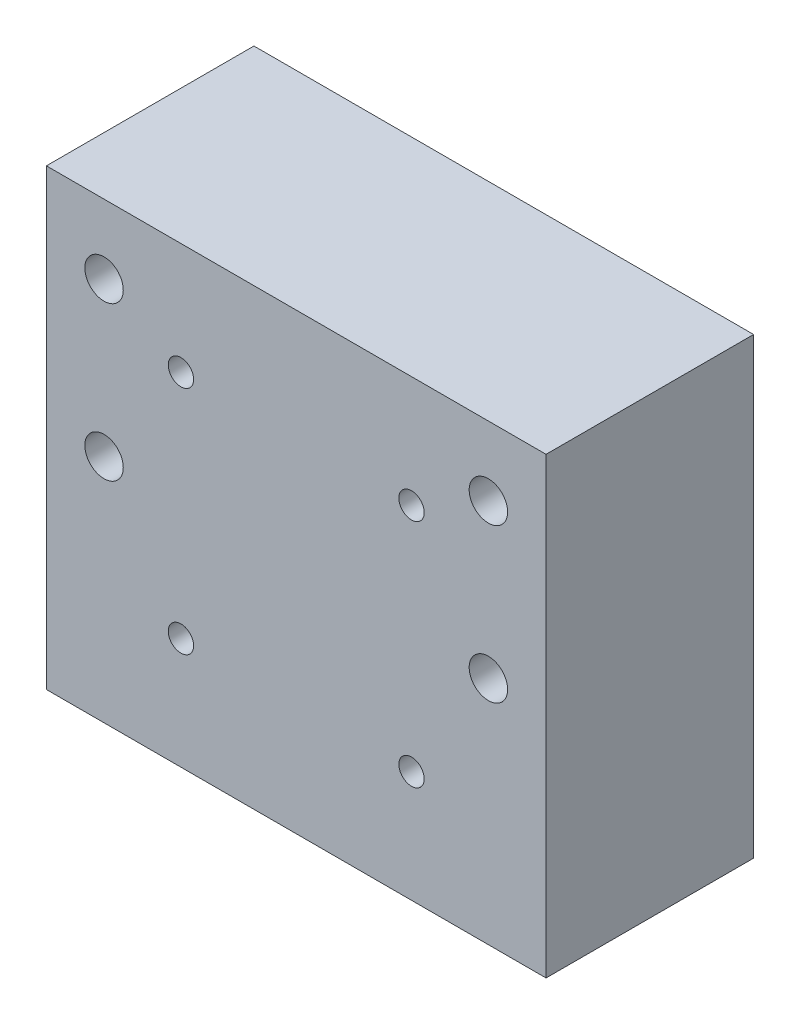
from build123d import *

# Parameters (mm, degrees)
SKETCH_1_W                  = 65
SKETCH_1_H                  = 59
EXTRUDE_1_DEPTH             = 27
SKETCH_2_R                  = 2.5
CUT_EXTRUDE_1_DEPTH         = 27
PATTERN_LINEAR_1_COUNT      = 2
PATTERN_LINEAR_1_PITCH      = 50
PATTERN_LINEAR_1_COUNT_DIR2 = 2
PATTERN_LINEAR_1_PITCH_DIR2 = 20
SKETCH_3_R                  = 1.65
CUT_EXTRUDE_2_DEPTH         = 27
PATTERN_LINEAR_2_COUNT      = 2
PATTERN_LINEAR_2_PITCH      = 30
PATTERN_LINEAR_2_COUNT_DIR2 = 2
PATTERN_LINEAR_2_PITCH_DIR2 = 30


with BuildPart() as part:
    # Эскиз1 → Бобышка-Вытянуть1 (new body)
    with BuildSketch(Plane.XY):
        Rectangle(SKETCH_1_W, SKETCH_1_H)
    extrude(amount=EXTRUDE_1_DEPTH)

    # Эскиз2 → Вырез-Вытянуть1 (cut)
    with BuildSketch(Plane.XY.offset(27)):
        with Locations((-25, 20.5)):
            Circle(SKETCH_2_R)
    cut_extrude_1 = extrude(amount=-CUT_EXTRUDE_1_DEPTH, mode=Mode.SUBTRACT)

    # Линейный массив1: Cut-Extrude 1 2 × 2
    with Locations(*[(i * PATTERN_LINEAR_1_PITCH, -j * PATTERN_LINEAR_1_PITCH_DIR2, 0) for i in range(PATTERN_LINEAR_1_COUNT) for j in range(PATTERN_LINEAR_1_COUNT_DIR2) if (i, j) != (0, 0)]):
        add(cut_extrude_1, mode=Mode.SUBTRACT)

    # Эскиз3 → Вырез-Вытянуть2 (cut)
    with BuildSketch(Plane.XY.offset(27)):
        with Locations((-15, 15)):
            Circle(SKETCH_3_R)
    cut_extrude_2 = extrude(amount=-CUT_EXTRUDE_2_DEPTH, mode=Mode.SUBTRACT)

    # Линейный массив2: Cut-Extrude 2 2 × 2
    with Locations(*[(i * PATTERN_LINEAR_2_PITCH, -j * PATTERN_LINEAR_2_PITCH_DIR2, 0) for i in range(PATTERN_LINEAR_2_COUNT) for j in range(PATTERN_LINEAR_2_COUNT_DIR2) if (i, j) != (0, 0)]):
        add(cut_extrude_2, mode=Mode.SUBTRACT)


solid = part.part
